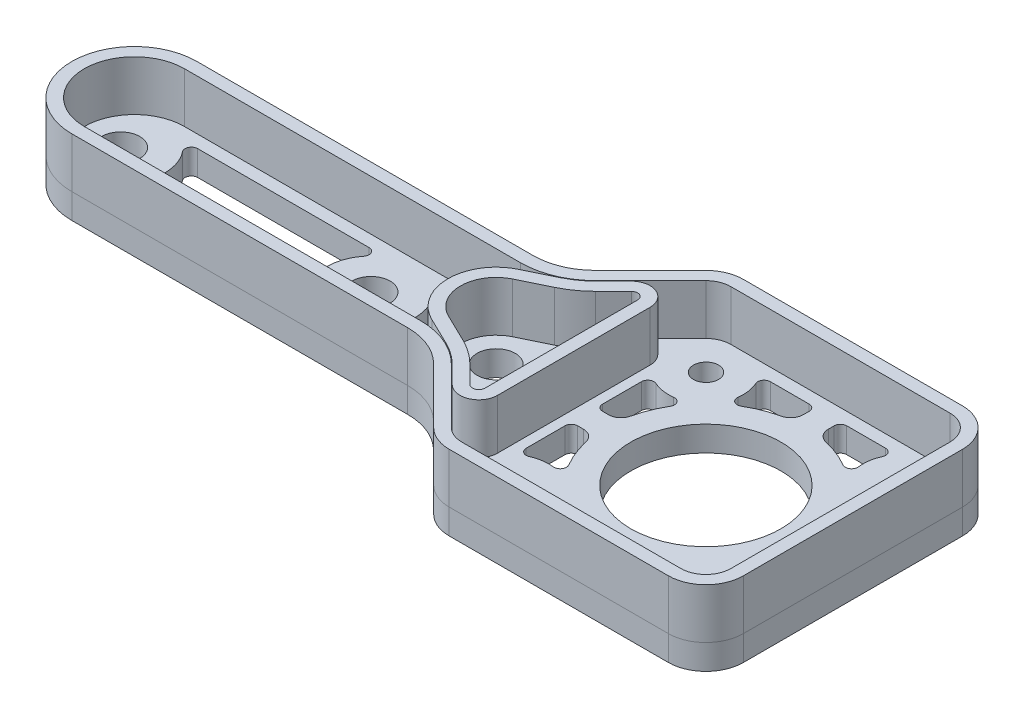
from build123d import *

# Parameters (mm, degrees)
SKETCH1_R           = 12
SKETCH1_R_2         = 2
SKETCH1_R_3         = 3.05
BOSS_EXTRUDE1_DEPTH = 4
EXTRUDE_THIN1_DEPTH = 8
EXTRUDE_THIN2_DEPTH = 8


with BuildPart() as part:
    # Sketch1 → Boss-Extrude1 (new body)
    with BuildSketch(Plane(origin=(0, 0, 0), x_dir=(1, 0, 0), z_dir=(0, 1, 0))):
        with BuildLine():
            Line((-91.3, 10), (-37.638467591, 10))
            ThreePointArc((-37.638467591, 10), (-33.814526369, 10.760006843), (-30.571829447, 12.924505293))
            Line((-30.571829447, 12.924505293), (-21.739982886, 21.745296824))
            ThreePointArc((-21.739982886, 21.745296824), (-19.794364733, 23.043995894), (-17.5, 23.5))
            Line((-17.5, 23.5), (17.5, 23.5))
            ThreePointArc((17.5, 23.5), (21.742640687, 21.742640687), (23.5, 17.5))
            Line((23.5, 17.5), (23.5, -17.5))
            ThreePointArc((23.5, -17.5), (21.742640687, -21.742640687), (17.5, -23.5))
            Line((17.5, -23.5), (-17.5, -23.5))
            ThreePointArc((-17.5, -23.5), (-19.794364733, -23.043995894), (-21.739982886, -21.745296824))
            Line((-21.739982886, -21.745296824), (-30.571829447, -12.924505293))
            ThreePointArc((-30.571829447, -12.924505293), (-33.814526369, -10.760006843), (-37.638467591, -10))
            Line((-37.638467591, -10), (-91.3, -10))
            ThreePointArc((-91.3, -10), (-101.3, 0), (-91.3, 10))
        make_face()
        with Locations(Location((0, 0, 0), (0, 0, 270))):
            Circle(SKETCH1_R, mode=Mode.SUBTRACT)
        with Locations(Location((-15.637811111, 15.662146765, 0), (0, 0, 270))):
            Circle(SKETCH1_R_2, mode=Mode.SUBTRACT)
        with Locations(Location((15.662146765, 15.637811111, 0), (0, 0, 270))):
            Circle(SKETCH1_R_2, mode=Mode.SUBTRACT)
        with Locations(Location((15.637811111, -15.662146765, 0), (0, 0, 270))):
            Circle(SKETCH1_R_2, mode=Mode.SUBTRACT)
        with Locations(Location((-15.662146765, -15.637811111, 0), (0, 0, 270))):
            Circle(SKETCH1_R_2, mode=Mode.SUBTRACT)
        with Locations(Location((-53.5, 0, 0), (0, 0, 270))):
            Circle(SKETCH1_R_3, mode=Mode.SUBTRACT)
        with Locations(Location((-33.5, 0, 0), (0, 0, 270))):
            Circle(SKETCH1_R_3, mode=Mode.SUBTRACT)
        with Locations(Location((-93.5, 0, 0), (0, 0, 270))):
            Circle(SKETCH1_R_3, mode=Mode.SUBTRACT)
        with BuildLine():
            Line((19.5, -3), (19.5, -9.206263146))
            ThreePointArc((19.5, -9.206263146), (19.041462955, -10.046987755), (18.086364264, -10.116705609))
            ThreePointArc((18.086364264, -10.116705609), (16.465532816, -9.638381302), (14.7756495, -9.624849747))
            ThreePointArc((14.7756495, -9.624849747), (13.810727907, -9.185503496), (13.78311178, -8.125627956))
            ThreePointArc((13.78311178, -8.125627956), (14.868163127, -5.910814262), (15.599936689, -3.555555556))
            ThreePointArc((15.599936689, -3.555555556), (16.302709646, -2.43652808), (17.549928775, -2))
            Line((17.549928775, -2), (18.5, -2))
            ThreePointArc((18.5, -2), (19.207106781, -2.292893219), (19.5, -3))
        make_face(mode=Mode.SUBTRACT)
        with BuildLine():
            Line((19.5, 9.206263146), (19.5, 3))
            ThreePointArc((19.5, 3), (19.207106781, 2.292893219), (18.5, 2))
            Line((18.5, 2), (17.549928775, 2))
            ThreePointArc((17.549928775, 2), (16.302709646, 2.43652808), (15.599936689, 3.555555556))
            ThreePointArc((15.599936689, 3.555555556), (14.868163127, 5.910814262), (13.78311178, 8.125627956))
            ThreePointArc((13.78311178, 8.125627956), (13.810727907, 9.185503495), (14.7756495, 9.624849747))
            ThreePointArc((14.7756495, 9.624849747), (16.465532816, 9.638381302), (18.086364264, 10.116705609))
            ThreePointArc((18.086364264, 10.116705609), (19.041462955, 10.046987755), (19.5, 9.206263146))
        make_face(mode=Mode.SUBTRACT)
        with BuildLine():
            Line((-59.808922253, 6), (-87.191077747, 6))
            ThreePointArc((-87.191077747, 6), (-88.091388252, 5.435248198), (-87.974794797, 4.378881988))
            ThreePointArc((-87.974794797, 4.378881988), (-86.45, 0), (-87.974794797, -4.378881988))
            ThreePointArc((-87.974794797, -4.378881988), (-88.091388252, -5.435248198), (-87.191077747, -6))
            Line((-87.191077747, -6), (-59.808922253, -6))
            ThreePointArc((-59.808922253, -6), (-58.908611748, -5.435248198), (-59.025205203, -4.378881988))
            ThreePointArc((-59.025205203, -4.378881988), (-60.55, 0), (-59.025205203, 4.378881988))
            ThreePointArc((-59.025205203, 4.378881988), (-58.908611748, 5.435248198), (-59.808922253, 6))
        make_face(mode=Mode.SUBTRACT)
        with BuildLine():
            Line((-47.191077747, 6), (-39.808922253, 6))
            ThreePointArc((-39.808922253, 6), (-38.908611748, 5.435248198), (-39.025205203, 4.378881988))
            ThreePointArc((-39.025205203, 4.378881988), (-40.55, 0), (-39.025205203, -4.378881988))
            ThreePointArc((-39.025205203, -4.378881988), (-38.908611748, -5.435248198), (-39.808922253, -6))
            Line((-39.808922253, -6), (-47.191077747, -6))
            ThreePointArc((-47.191077747, -6), (-48.091388252, -5.435248198), (-47.974794797, -4.378881988))
            ThreePointArc((-47.974794797, -4.378881988), (-46.45, 0), (-47.974794797, 4.378881988))
            ThreePointArc((-47.974794797, 4.378881988), (-48.091388252, 5.435248198), (-47.191077747, 6))
        make_face(mode=Mode.SUBTRACT)
        with BuildLine():
            Line((-3, -19.5), (-9.206263146, -19.5))
            ThreePointArc((-9.206263146, -19.5), (-10.046987755, -19.041462955), (-10.116705609, -18.086364264))
            ThreePointArc((-10.116705609, -18.086364264), (-9.638381302, -16.465532816), (-9.624849747, -14.7756495))
            ThreePointArc((-9.624849747, -14.7756495), (-9.185503496, -13.810727907), (-8.125627956, -13.78311178))
            ThreePointArc((-8.125627956, -13.78311178), (-5.910814262, -14.868163127), (-3.555555556, -15.599936689))
            ThreePointArc((-3.555555556, -15.599936689), (-2.43652808, -16.302709646), (-2, -17.549928775))
            Line((-2, -17.549928775), (-2, -18.5))
            ThreePointArc((-2, -18.5), (-2.292893219, -19.207106781), (-3, -19.5))
        make_face(mode=Mode.SUBTRACT)
        with BuildLine():
            Line((9.206263146, -19.5), (3, -19.5))
            ThreePointArc((3, -19.5), (2.292893219, -19.207106781), (2, -18.5))
            Line((2, -18.5), (2, -17.549928775))
            ThreePointArc((2, -17.549928775), (2.43652808, -16.302709646), (3.555555556, -15.599936689))
            ThreePointArc((3.555555556, -15.599936689), (5.910814262, -14.868163127), (8.125627956, -13.78311178))
            ThreePointArc((8.125627956, -13.78311178), (9.185503495, -13.810727907), (9.624849747, -14.7756495))
            ThreePointArc((9.624849747, -14.7756495), (9.638381302, -16.465532816), (10.116705609, -18.086364264))
            ThreePointArc((10.116705609, -18.086364264), (10.046987755, -19.041462955), (9.206263146, -19.5))
        make_face(mode=Mode.SUBTRACT)
        with BuildLine():
            Line((-19.5, 3), (-19.5, 9.206263146))
            ThreePointArc((-19.5, 9.206263146), (-19.041462955, 10.046987755), (-18.086364264, 10.116705609))
            ThreePointArc((-18.086364264, 10.116705609), (-16.465532816, 9.638381302), (-14.7756495, 9.624849747))
            ThreePointArc((-14.7756495, 9.624849747), (-13.810727907, 9.185503495), (-13.78311178, 8.125627956))
            ThreePointArc((-13.78311178, 8.125627956), (-14.868163127, 5.910814262), (-15.599936689, 3.555555556))
            ThreePointArc((-15.599936689, 3.555555556), (-16.302709646, 2.43652808), (-17.549928775, 2))
            Line((-17.549928775, 2), (-18.5, 2))
            ThreePointArc((-18.5, 2), (-19.207106781, 2.292893219), (-19.5, 3))
        make_face(mode=Mode.SUBTRACT)
        with BuildLine():
            Line((-19.5, -9.206263146), (-19.5, -3))
            ThreePointArc((-19.5, -3), (-19.207106781, -2.292893219), (-18.5, -2))
            Line((-18.5, -2), (-17.549928775, -2))
            ThreePointArc((-17.549928775, -2), (-16.302709646, -2.43652808), (-15.599936689, -3.555555556))
            ThreePointArc((-15.599936689, -3.555555556), (-14.868163127, -5.910814262), (-13.78311178, -8.125627956))
            ThreePointArc((-13.78311178, -8.125627956), (-13.810727907, -9.185503495), (-14.7756495, -9.624849747))
            ThreePointArc((-14.7756495, -9.624849747), (-16.465532816, -9.638381302), (-18.086364264, -10.116705609))
            ThreePointArc((-18.086364264, -10.116705609), (-19.041462955, -10.046987755), (-19.5, -9.206263146))
        make_face(mode=Mode.SUBTRACT)
        with BuildLine():
            Line((-9.206263146, 19.5), (-3, 19.5))
            ThreePointArc((-3, 19.5), (-2.292893219, 19.207106781), (-2, 18.5))
            Line((-2, 18.5), (-2, 17.549928775))
            ThreePointArc((-2, 17.549928775), (-2.43652808, 16.302709646), (-3.555555556, 15.599936689))
            ThreePointArc((-3.555555556, 15.599936689), (-5.910814262, 14.868163127), (-8.125627956, 13.78311178))
            ThreePointArc((-8.125627956, 13.78311178), (-9.185503495, 13.810727907), (-9.624849747, 14.7756495))
            ThreePointArc((-9.624849747, 14.7756495), (-9.638381302, 16.465532816), (-10.116705609, 18.086364264))
            ThreePointArc((-10.116705609, 18.086364264), (-10.046987755, 19.041462955), (-9.206263146, 19.5))
        make_face(mode=Mode.SUBTRACT)
        with BuildLine():
            Line((2, 18.5), (2, 17.549928775))
            ThreePointArc((2, 17.549928775), (2.43652808, 16.302709646), (3.555555556, 15.599936689))
            ThreePointArc((3.555555556, 15.599936689), (5.910814262, 14.868163127), (8.125627956, 13.78311178))
            ThreePointArc((8.125627956, 13.78311178), (9.185503495, 13.810727907), (9.624849747, 14.7756495))
            ThreePointArc((9.624849747, 14.7756495), (9.638381302, 16.465532816), (10.116705609, 18.086364264))
            ThreePointArc((10.116705609, 18.086364264), (10.046987755, 19.041462955), (9.206263146, 19.5))
            Line((9.206263146, 19.5), (3, 19.5))
            ThreePointArc((3, 19.5), (2.292893219, 19.207106781), (2, 18.5))
        make_face(mode=Mode.SUBTRACT)
        with BuildLine():
            Line((-23.5, -3), (-23.5, -11.922090802))
            ThreePointArc((-23.5, -11.922090802), (-24.117027295, -12.845850461), (-25.206663814, -12.629640272))
            Line((-25.206663814, -12.629640272), (-30.170133033, -7.672383945))
            ThreePointArc((-30.170133033, -7.672383945), (-30.455062302, -6.835439125), (-29.964901614, -6.099637645))
            ThreePointArc((-29.964901614, -6.099637645), (-28.170653661, -4.615253795), (-26.95785652, -2.627329193))
            ThreePointArc((-26.95785652, -2.627329193), (-26.589950578, -2.171546378), (-26.029892906, -2))
            Line((-26.029892906, -2), (-24.5, -2))
            ThreePointArc((-24.5, -2), (-23.792893219, -2.292893219), (-23.5, -3))
        make_face(mode=Mode.SUBTRACT)
        with BuildLine():
            Line((-25.206663814, 12.629640272), (-30.170133033, 7.672383945))
            ThreePointArc((-30.170133033, 7.672383945), (-30.455062302, 6.835439125), (-29.964901614, 6.099637645))
            ThreePointArc((-29.964901614, 6.099637645), (-28.170653661, 4.615253795), (-26.95785652, 2.627329193))
            ThreePointArc((-26.95785652, 2.627329193), (-26.589950578, 2.171546378), (-26.029892906, 2))
            Line((-26.029892906, 2), (-24.5, 2))
            ThreePointArc((-24.5, 2), (-23.792893219, 2.292893219), (-23.5, 3))
            Line((-23.5, 3), (-23.5, 11.922090802))
            ThreePointArc((-23.5, 11.922090802), (-24.117027295, 12.845850461), (-25.206663814, 12.629640272))
        make_face(mode=Mode.SUBTRACT)
    extrude(amount=BOSS_EXTRUDE1_DEPTH)


with BuildPart() as body_2:
    # Sketch4 → Extrude-Thin1 (new body)
    with BuildSketch(Plane(origin=(0, 4, 0), x_dir=(1, 0, 0), z_dir=(0, 1, 0))):
        with BuildLine():
            Line((-21.739982886, 21.745296824), (-30.571829447, 12.924505293))
            ThreePointArc((-30.571829447, 12.924505293), (-33.814526369, 10.760006843), (-37.638467591, 10))
            Line((-37.638467591, 10), (-91.3, 10))
            ThreePointArc((-91.3, 10), (-101.3, 0), (-91.3, -10))
            Line((-91.3, -10), (-37.638467591, -10))
            ThreePointArc((-37.638467591, -10), (-33.814526369, -10.760006843), (-30.571829447, -12.924505293))
            Line((-30.571829447, -12.924505293), (-21.739982886, -21.745296824))
            ThreePointArc((-21.739982886, -21.745296824), (-19.794364733, -23.043995894), (-17.5, -23.5))
            Line((-17.5, -23.5), (17.5, -23.5))
            ThreePointArc((17.5, -23.5), (21.742640687, -21.742640687), (23.5, -17.5))
            Line((23.5, -17.5), (23.5, 17.5))
            ThreePointArc((23.5, 17.5), (21.742640687, 21.742640687), (17.5, 23.5))
            Line((17.5, 23.5), (-17.5, 23.5))
            ThreePointArc((-17.5, 23.5), (-19.794364733, 23.043995894), (-21.739982886, 21.745296824))
        make_face()
        with BuildLine():
            Line((-20.326655258, 20.330197883), (-29.158501818, 11.509406352))
            ThreePointArc((-29.158501818, 11.509406352), (-33.049738125, 8.912008212), (-37.638467591, 8))
            Line((-37.638467591, 8), (-91.3, 8))
            ThreePointArc((-91.3, 8), (-99.3, 0), (-91.3, -8))
            Line((-91.3, -8), (-37.638467591, -8))
            ThreePointArc((-37.638467591, -8), (-33.049738125, -8.912008212), (-29.158501818, -11.509406352))
            Line((-29.158501818, -11.509406352), (-20.326655258, -20.330197883))
            ThreePointArc((-20.326655258, -20.330197883), (-19.029576489, -21.195997263), (-17.5, -21.5))
            Line((-17.5, -21.5), (17.5, -21.5))
            ThreePointArc((17.5, -21.5), (20.328427125, -20.328427125), (21.5, -17.5))
            Line((21.5, -17.5), (21.5, 17.5))
            ThreePointArc((21.5, 17.5), (20.328427125, 20.328427125), (17.5, 21.5))
            Line((17.5, 21.5), (-17.5, 21.5))
            ThreePointArc((-17.5, 21.5), (-19.029576489, 21.195997263), (-20.326655258, 20.330197883))
        make_face(mode=Mode.SUBTRACT)
    extrude(amount=EXTRUDE_THIN1_DEPTH)


with BuildPart() as body_3:
    # Sketch5 → Extrude-Thin2 (new body)
    with BuildSketch(Plane(origin=(0, 4, 0), x_dir=(1, 0, 0), z_dir=(0, 1, 0))):
        with BuildLine():
            Line((-26.219991443, 14.302905651), (-29.087835437, 11.438651405))
            ThreePointArc((-29.087835437, 11.438651405), (-30.624783425, 10.140069248), (-32.355673589, 9.114133588))
            Line((-32.355673589, 9.114133588), (-36.861778001, 6.927369535))
            ThreePointArc((-36.861778001, 6.927369535), (-41.2, 0), (-36.861778001, -6.927369535))
            Line((-36.861778001, -6.927369535), (-32.355673589, -9.114133588))
            ThreePointArc((-32.355673589, -9.114133588), (-30.624783425, -10.140069248), (-29.087835437, -11.438651405))
            Line((-29.087835437, -11.438651405), (-26.219991443, -14.302905651))
            ThreePointArc((-26.219991443, -14.302905651), (-22.951081885, -14.951536215), (-21.1, -12.180257239))
            Line((-21.1, -12.180257239), (-21.1, 12.180257239))
            ThreePointArc((-21.1, 12.180257239), (-22.951081885, 14.951536215), (-26.219991443, 14.302905651))
        make_face()
        with BuildLine():
            Line((-24.806663814, 12.887806709), (-27.674507808, 10.023552464))
            ThreePointArc((-27.674507808, 10.023552464), (-29.465496786, 8.510328628), (-31.482484498, 7.314816826))
            Line((-31.482484498, 7.314816826), (-35.98858891, 5.128052772))
            ThreePointArc((-35.98858891, 5.128052772), (-39.2, 0), (-35.98858891, -5.128052773))
            Line((-35.98858891, -5.128052773), (-31.482484498, -7.314816826))
            ThreePointArc((-31.482484498, -7.314816826), (-29.465496786, -8.510328628), (-27.674507808, -10.023552464))
            Line((-27.674507808, -10.023552464), (-24.806663814, -12.887806709))
            ThreePointArc((-24.806663814, -12.887806709), (-23.717027295, -13.104016897), (-23.1, -12.180257239))
            Line((-23.1, -12.180257239), (-23.1, 12.180257239))
            ThreePointArc((-23.1, 12.180257239), (-23.717027295, 13.104016897), (-24.806663814, 12.887806709))
        make_face(mode=Mode.SUBTRACT)
    extrude(amount=EXTRUDE_THIN2_DEPTH)


solid = Compound([part.part, body_2.part, body_3.part])
